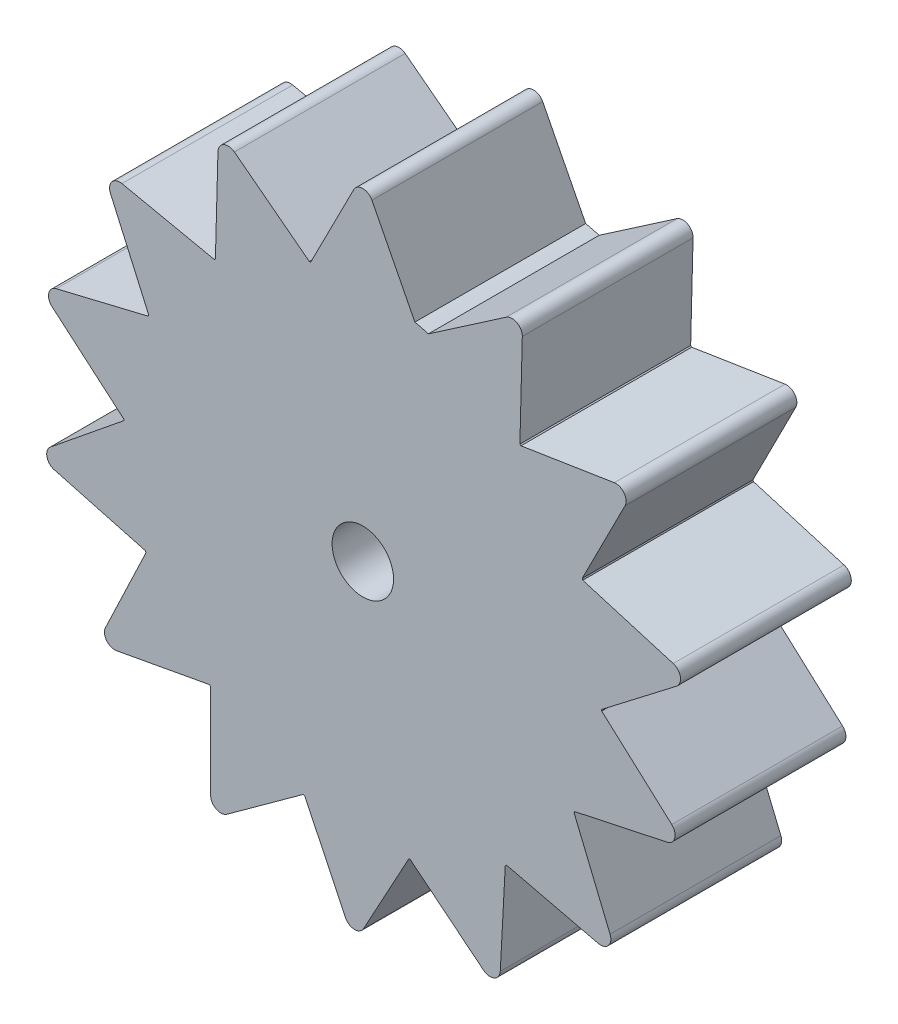
from build123d import *

# Parameters (mm, degrees)
SKETCH1_R           = 7
SKETCH1_R_2         = 0.9
BOSS_EXTRUDE1_DEPTH = 5
BOSS_EXTRUDE2_START = -5
BOSS_EXTRUDE2_DEPTH = 5
CIRPATTERN1_COUNT   = 14
CIRPATTERN1_ANGLE   = 331.5


with BuildPart() as part:
    # Sketch1 → Boss-Extrude1 (new body)
    with BuildSketch(Plane.XY):
        Circle(SKETCH1_R)
        Circle(SKETCH1_R_2, mode=Mode.SUBTRACT)
    extrude(amount=BOSS_EXTRUDE1_DEPTH)

    # Sketch2 → Boss-Extrude2 (add)
    with BuildSketch(Plane.XY.offset(5).offset(BOSS_EXTRUDE2_START)):
        with BuildLine():
            ThreePointArc((0.267172205, 9.293419284), (0, 9.456967781), (-0.267172205, 9.293419284))
            Line((-0.267172205, 9.293419284), (-1.524265806, 6.832028524))
            ThreePointArc((-1.524265806, 6.832028524), (0, 7), (1.524265806, 6.832028524))
            Line((1.524265806, 6.832028524), (0.267172205, 9.293419284))
        make_face()
    boss_extrude2 = extrude(amount=BOSS_EXTRUDE2_DEPTH)

    # CirPattern1: Boss-Extrude2 ×14 about axis
    cirpattern1_axis = Axis((0, 0, 0), (0, 0, 1))
    for i in range(1, CIRPATTERN1_COUNT):
        add(boss_extrude2.rotate(cirpattern1_axis, i * CIRPATTERN1_ANGLE / (CIRPATTERN1_COUNT - 1)))


solid = part.part
